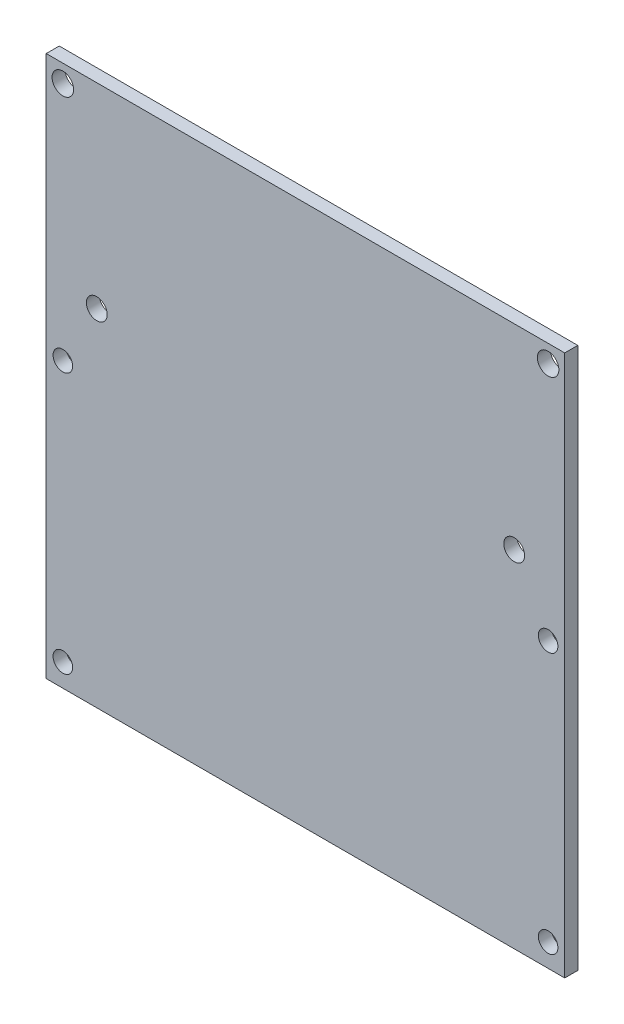
from build123d import *

# Parameters (mm, degrees)
SKETCH_1_W          = 79.5
SKETCH_1_H          = 83
EXTRUDE_1_DEPTH     = 2
SKETCH_2_R          = 1.5
SKETCH_2_R_2        = 1.65
CUT_EXTRUDE_1_DEPTH = 3
CUT_EXTRUDE_2_REACH = 116.949
SKETCH_3_R          = 1.6


with BuildPart() as part:
    # 草图1 → 凸台-拉伸1 (new body)
    with BuildSketch(Plane.XY):
        with Locations((39.75, -41.5)):
            Rectangle(SKETCH_1_W, SKETCH_1_H)
    extrude(amount=EXTRUDE_1_DEPTH)

    # 草图2 → 切除-拉伸1 (cut)
    with BuildSketch(Plane.XY.offset(2)):
        with Locations((2.55, -79.5)):
            Circle(SKETCH_2_R)
        with Locations((2.55, -39.5)):
            Circle(SKETCH_2_R)
        with Locations((76.95, -39.5)):
            Circle(SKETCH_2_R)
        with Locations((76.95, -79.5)):
            Circle(SKETCH_2_R)
        with Locations((2.55, -2.7)):
            Circle(SKETCH_2_R_2)
        with Locations(Location((76.95, -2.7, 0), (0, 0, 180))):
            Circle(SKETCH_2_R_2)
    extrude(amount=-CUT_EXTRUDE_1_DEPTH, mode=Mode.SUBTRACT)

    # 草图3 → 切除-拉伸2 (cut, up to next)
    with BuildSketch(Plane.XY, mode=Mode.PRIVATE) as cut_extrude_2_sk1:
        with Locations(Location((7.75, -30, 0), (0, 0, 180))):
            Circle(SKETCH_3_R)
    cut_extrude_2_tool1 = extrude(cut_extrude_2_sk1.sketch, amount=CUT_EXTRUDE_2_REACH, mode=Mode.PRIVATE) & part.part
    # 草图3 → 切除-拉伸2 (cut, up to next)
    with BuildSketch(Plane.XY, mode=Mode.PRIVATE) as cut_extrude_2_sk2:
        with Locations(Location((71.75, -30, 0), (0, 0, 180))):
            Circle(SKETCH_3_R)
    cut_extrude_2_tool2 = extrude(cut_extrude_2_sk2.sketch, amount=CUT_EXTRUDE_2_REACH, mode=Mode.PRIVATE) & part.part
    add(cut_extrude_2_tool1.solids().sort_by_distance((7.75, -30, 0))[0], mode=Mode.SUBTRACT)
    add(cut_extrude_2_tool2.solids().sort_by_distance((71.75, -30, 0))[0], mode=Mode.SUBTRACT)


solid = part.part
